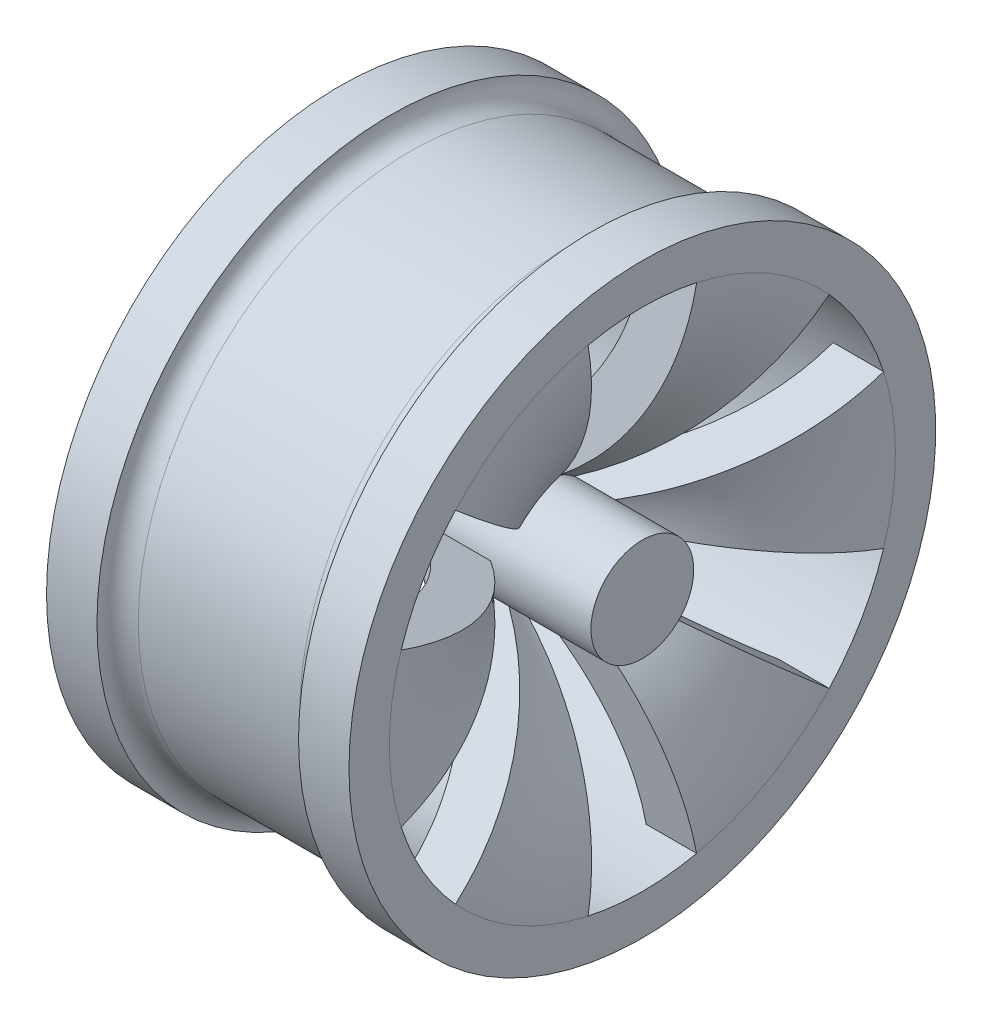
from build123d import *
from build123d.topology import SkipClean

# Parameters (mm, degrees)
CROQUIS2_R              = 5.1
CROQUIS2_R_2            = 2.1
SALIENTE_EXTRUIR1_DEPTH = 30
SALIENTE_EXTRUIR2_START = -5
CROQUIS3_R              = 5.1
SALIENTE_EXTRUIR2_DEPTH = 5
CORTAR_EXTRUIR1_START   = -17
CORTAR_EXTRUIR1_DEPTH   = 17
MATRIZC1_COUNT          = 6
CROQUIS5_R              = 1.6
CORTAR_EXTRUIR2_DEPTH   = 6


with BuildPart() as part:
    # Croquis1 → Revolución1 (revolve)
    with BuildSketch(Plane.XY, mode=Mode.PRIVATE) as revoluci_n1_sk:
        with BuildLine():
            Line((15, 25.1), (15, 29.1))
            Line((15, 29.1), (9.997498436, 29.1))
            ThreePointArc((9.997498436, 29.1), (9.449137675, 27.621595125), (8, 27))
            Line((8, 27), (-8, 27))
            ThreePointArc((-8, 27), (-9.449137675, 27.621595125), (-9.997498436, 29.1))
            Line((-9.997498436, 29.1), (-15, 29.1))
            Line((-15, 29.1), (-15, 25.1))
            Line((-15, 25.1), (-10, 25.1))
            Line((-10, 25.1), (10, 25.1))
            ThreePointArc((10, 25.1), (7.329815552, 14.805658027), (0, 7.1))
            ThreePointArc((0, 7.1), (-0.91680134, 6.01680134), (-2, 5.1))
            Line((-2, 5.1), (-17, 5.1))
            Line((-17, 5.1), (-17, 2.1))
            Line((-17, 2.1), (0, 2.1))
            ThreePointArc((0, 2.1), (10.838187511, 11.422921189), (15, 25.1))
        make_face()
    revolve(revoluci_n1_sk.sketch.rotate(Axis((0, 0, 0), (1, 0, 0)), 90), axis=Axis((0, 0, 0), (1, 0, 0)))

    # Croquis2 → Saliente-Extruir1 (add)
    with BuildSketch(Plane.ZY.offset(15)):
        Circle(CROQUIS2_R)
        Circle(CROQUIS2_R_2, mode=Mode.SUBTRACT)
    extrude(amount=-SALIENTE_EXTRUIR1_DEPTH)

    # Croquis3 → Saliente-Extruir2 (add)
    with BuildSketch(Plane(origin=(15, 0, 0), x_dir=(0, 0, -1), z_dir=(1, 0, 0)).offset(SALIENTE_EXTRUIR2_START)):
        with Locations(Location((0, 0, 0), (0, 0, 180))):
            Circle(CROQUIS3_R)
    extrude(amount=SALIENTE_EXTRUIR2_DEPTH)

    # Croquis4 → Cortar-Extruir1 (cut)
    with BuildSketch(Plane(origin=(15, 0, 0), x_dir=(0, 0, -1), z_dir=(1, 0, 0)).offset(CORTAR_EXTRUIR1_START)):
        with BuildLine():
            Line((-1.810994472, 4.767630336), (-5.385168073, 24.51550458))
            ThreePointArc((-5.385168073, 24.51550458), (0, 25.1), (5.385168073, 24.51550458))
            Line((5.385168073, 24.51550458), (1.806786702, 4.769226543))
            ThreePointArc((1.806786702, 4.769226543), (-0.002250178, 5.099999504), (-1.810994472, 4.767630336))
        make_face()
    cortar_extruir1 = extrude(amount=CORTAR_EXTRUIR1_DEPTH, mode=Mode.SUBTRACT)

    # MatrizC1: Cortar-Extruir1 ×6 about axis
    with SkipClean():  # the faces are left unmerged after this step: merging them gives an invalid solid
        matrizc1_axis = Axis((0, 0, 0), (1, 0, 0))
        for i in range(1, MATRIZC1_COUNT):
            add(cortar_extruir1.rotate(matrizc1_axis, i * 360 / MATRIZC1_COUNT), mode=Mode.SUBTRACT)

    # Croquis5 → Cortar-Extruir2 (cut)
    with SkipClean():  # the faces are left unmerged after this step: merging them gives an invalid solid
        with BuildSketch(Plane(origin=(0, 6, 0), x_dir=(1, 0, 0), z_dir=(0, 1, 0))):
            with Locations(Location((-15, 0, 0), (0, 0, 270))):
                Circle(CROQUIS5_R)
        extrude(amount=-CORTAR_EXTRUIR2_DEPTH, mode=Mode.SUBTRACT)


solid = part.part
